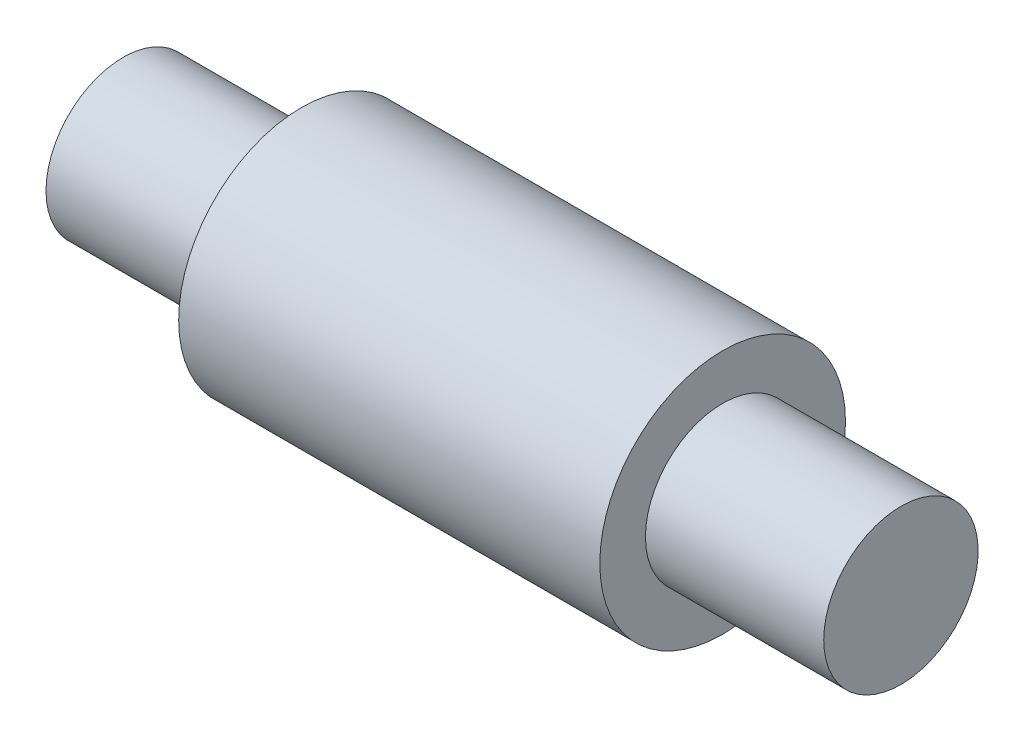
from build123d import *


with BuildPart() as part:
    # CV_Western_4M Sketch → CV_Western_4M (revolve)
    with BuildSketch(Plane.XY):
        Polygon((12.7, 0), (12.7, 5.5), (0, 5.5), (0, 8.75), (-30, 8.75), (-30, 5.5), (-42.7, 5.5), (-42.7, 0), align=None)
    revolve(axis=Axis((-1000, 0, 0), (1, 0, 0)))


solid = part.part
